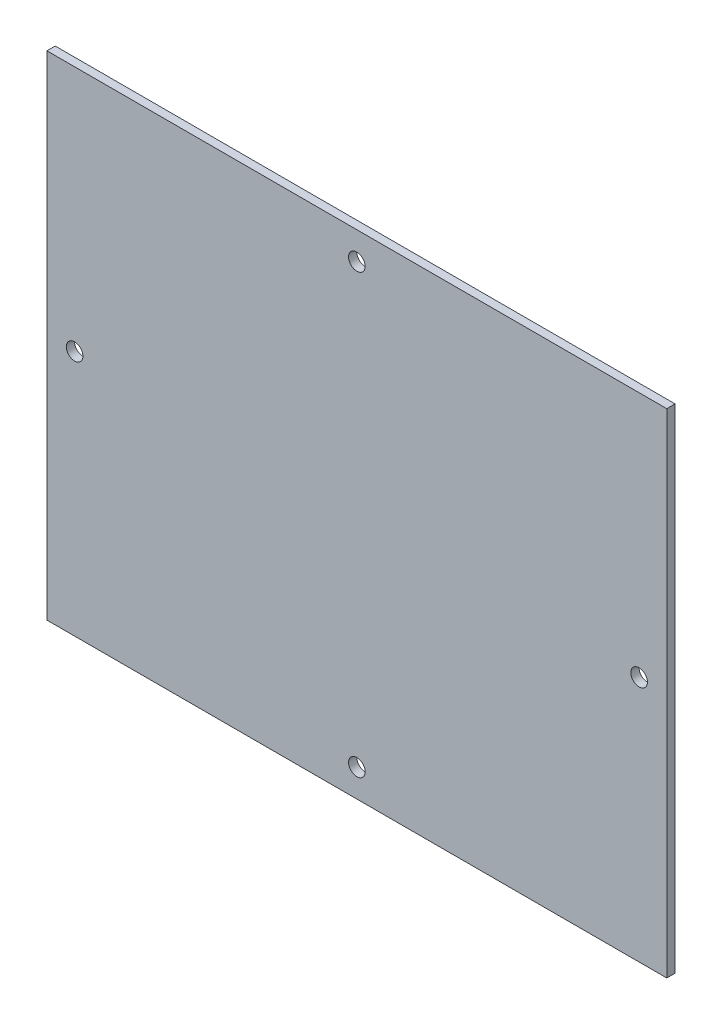
from build123d import *

# Parameters (mm, degrees)
SKETCH_1_W      = 112
SKETCH_1_H      = 89.09
SKETCH_1_R      = 1.5
EXTRUDE_1_DEPTH = 1.5


with BuildPart() as part:
    # 草图1 → 凸台-拉伸1 (new body)
    with BuildSketch(Plane.XY):
        with Locations((-60.21014197, 59.696974736)):
            Rectangle(SKETCH_1_W, SKETCH_1_H)
        with Locations((-60.21014197, 99.241974736)):
            Circle(SKETCH_1_R, mode=Mode.SUBTRACT)
        with Locations((-111.21014197, 59.696974736)):
            Circle(SKETCH_1_R, mode=Mode.SUBTRACT)
        with Locations(Location((-60.21014197, 20.151974736, 0), (0, 0, 180))):
            Circle(SKETCH_1_R, mode=Mode.SUBTRACT)
        with Locations(Location((-9.21014197, 59.696974736, 0), (0, 0, 180))):
            Circle(SKETCH_1_R, mode=Mode.SUBTRACT)
    extrude(amount=EXTRUDE_1_DEPTH)


solid = part.part
